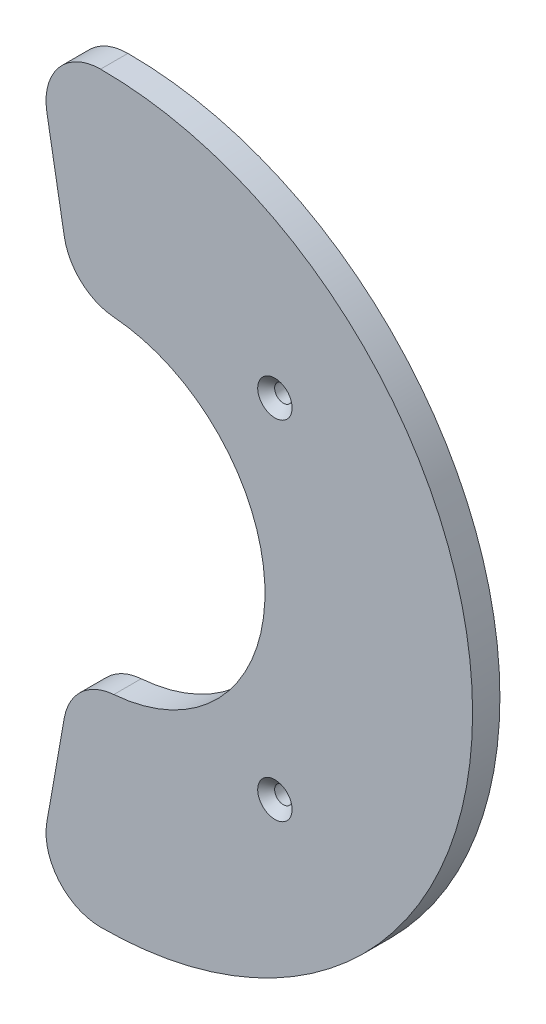
from build123d import *

# Parameters (mm, degrees)
SKETCH_1_R                   = 1.6
EXTRUDE_1_DEPTH              = 5
FILLET_1_R                   = 10
HOLE_WIZARD_M3_1_D           = 3.2
HOLE_WIZARD_M3_1_CSINK_D     = 6.3
HOLE_WIZARD_M3_1_CSINK_ANGLE = 90
SKETCH_5_R                   = 3
CUT_EXTRUDE_1_DEPTH          = 1


with BuildPart() as part:
    # ｽｹｯﾁ1 → ﾎﾞｽ - 押し出し1 (new body)
    with BuildSketch(Plane.XY):
        with BuildLine():
            Line((-5.20944533, 29.54423259), (-11.808076081, 66.966927205))
            ThreePointArc((-11.808076081, 66.966927205), (68, 0), (-11.808076081, -66.966927205))
            Line((-11.808076081, -66.966927205), (-5.20944533, -29.54423259))
            ThreePointArc((-5.20944533, -29.54423259), (30, 0), (-5.20944533, 29.54423259))
        make_face()
        with Locations((31.819805153, 31.819805153)):
            Circle(SKETCH_1_R, mode=Mode.SUBTRACT)
        with Locations(Location((31.819805153, -31.819805153, 0), (0, 0, 180))):
            Circle(SKETCH_1_R, mode=Mode.SUBTRACT)
    extrude(amount=EXTRUDE_1_DEPTH)

    # ﾌｨﾚｯﾄ1
    fillet_1_edges = [part.edges().sort_by_distance(p)[0] for p in [
        (-11.808076081, -66.966927205, 2.5),
        (-5.20944533, -29.54423259, 2.5),
        (-5.20944533, 29.54423259, 2.5),
        (-11.808076081, 66.966927205, 2.5),
    ]]
    fillet(fillet_1_edges, radius=FILLET_1_R)

    # M3 丸皿ねじ用皿穴1 (through all)
    with Locations(Plane.XY.offset(5)):
        with Locations((31.819805153, 31.819805153), (31.819805153, -31.819805153)):
            CounterSinkHole(HOLE_WIZARD_M3_1_D / 2, HOLE_WIZARD_M3_1_CSINK_D / 2, counter_sink_angle=HOLE_WIZARD_M3_1_CSINK_ANGLE)

    # ｽｹｯﾁ5 → ｶｯﾄ - 押し出し1 (cut)
    with BuildSketch(Plane(origin=(0, 0, 0), x_dir=(-1, 0, 0), z_dir=(0, 0, -1))):
        with Locations((-31.819805153, 31.819805153)):
            Circle(SKETCH_5_R)
        with Locations(Location((-31.819805153, -31.819805153, 0), (0, 0, 180))):
            Circle(SKETCH_5_R)
    extrude(amount=-CUT_EXTRUDE_1_DEPTH, mode=Mode.SUBTRACT)


solid = part.part
